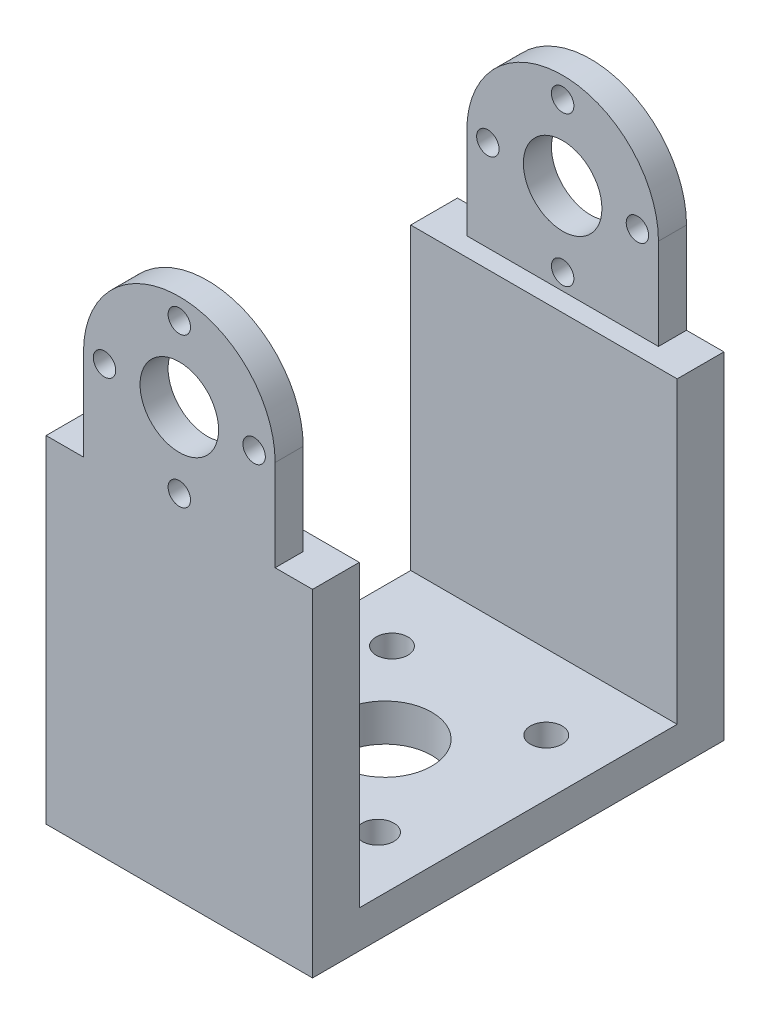
from build123d import *

# Parameters (mm, degrees)
BOSS_EXTRUDE1_DEPTH      = 22
BOSS_EXTRUDE1_DEPTH_BACK = 22
SKETCH1_R                = 1.2
SKETCH1_R_2              = 4.2
SKETCH2_W                = 38
SKETCH2_H                = 20
CUT_EXTRUDE1_DEPTH       = 105.423416914
SKETCH3_W                = 7
SKETCH3_H                = 44
BOSS_EXTRUDE2_DEPTH      = 36
SKETCH5_W                = 34
SKETCH5_H                = 50
CUT_EXTRUDE3_DEPTH       = 109.047443283
SKETCH6_W                = 20.5
SKETCH6_H                = 54.25
CUT_EXTRUDE4_DEPTH       = 111.605436123
SKETCH20_W               = 28.5
SKETCH20_H               = 34
SKETCH20_R               = 1.7
SKETCH20_R_2             = 5
BOSS_EXTRUDE5_DEPTH      = 4
SKETCH21_W               = 3
SKETCH21_H               = 36
CUT_EXTRUDE12_DEPTH      = 66.777085676


with BuildPart() as part:
    # Sketch1 → Boss-Extrude1 (new, two sides: drawn at the far end of the back side and taken through both)
    with BuildSketch(Plane.XY.offset(-BOSS_EXTRUDE1_DEPTH_BACK)):
        with BuildLine():
            ThreePointArc((10.25, 0), (0, 10.25), (-10.25, 0))
            Line((-10.25, 0), (-10.25, -100))
            Line((-10.25, -100), (10.25, -100))
            Line((10.25, -100), (10.25, 0))
        make_face()
        with Locations((8, 0)):
            Circle(SKETCH1_R, mode=Mode.SUBTRACT)
        with Locations((0, 8)):
            Circle(SKETCH1_R, mode=Mode.SUBTRACT)
        with Locations((-8, 0)):
            Circle(SKETCH1_R, mode=Mode.SUBTRACT)
        Circle(SKETCH1_R_2, mode=Mode.SUBTRACT)
        with Locations((0, -8)):
            Circle(SKETCH1_R, mode=Mode.SUBTRACT)
    extrude(amount=BOSS_EXTRUDE1_DEPTH + BOSS_EXTRUDE1_DEPTH_BACK)

    # Sketch2 → Cut-Extrude1 (cut, through all)
    with BuildSketch(Plane.ZY.offset(10.25)):
        with Locations((0, 0.25)):
            Rectangle(SKETCH2_W, SKETCH2_H)
    extrude(amount=-CUT_EXTRUDE1_DEPTH, mode=Mode.SUBTRACT)

    # Sketch3 → Boss-Extrude2 (add)
    with BuildSketch(Plane(origin=(0, -9.75, 0), x_dir=(1, 0, 0), z_dir=(0, 1, 0))):
        with Locations((-13.75, 0)):
            Rectangle(SKETCH3_W, SKETCH3_H)
        with Locations((13.75, 0)):
            Rectangle(SKETCH3_W, SKETCH3_H)
    extrude(amount=-BOSS_EXTRUDE2_DEPTH)

    # Sketch5 → Cut-Extrude3 (cut, through all)
    with BuildSketch(Plane.ZY.offset(17.25)):
        with Locations((0, -34.75)):
            Rectangle(SKETCH5_W, SKETCH5_H)
    extrude(amount=-CUT_EXTRUDE3_DEPTH, mode=Mode.SUBTRACT)

    # Sketch6 → Cut-Extrude4 (cut, through all)
    with BuildSketch(Plane.XY.offset(22)):
        with Locations((0, -72.875)):
            Rectangle(SKETCH6_W, SKETCH6_H)
    extrude(amount=-CUT_EXTRUDE4_DEPTH, mode=Mode.SUBTRACT)


with BuildPart() as cut_extrude4_piece_1:
    # of the separate pieces the step leaves, piece 1, a body of its own (cut_extrude4_pieces)
    add(part.part.solids().sort_by_distance((17.25, -45.75, -17))[0])



with BuildPart() as cut_extrude4_piece_2:
    # of the separate pieces the step leaves, piece 2, a body of its own (cut_extrude4_pieces)
    add(part.part.solids().sort_by_distance((-10.25, 0, 22))[0])


with BuildPart() as cut_extrude4_piece_1_1:
    add(cut_extrude4_piece_1.part)

    add(cut_extrude4_piece_2.part)  # Boss-Extrude5 merges Cut-Extrude4 piece 2
    # Sketch20 → Boss-Extrude5 (add)
    with BuildSketch(Plane.XZ.offset(45.75)):
        Rectangle(SKETCH20_W, SKETCH20_H)
        with Locations((-8.25, -9)):
            Circle(SKETCH20_R, mode=Mode.SUBTRACT)
        with Locations((8.25, -9)):
            Circle(SKETCH20_R, mode=Mode.SUBTRACT)
        with Locations((-8.25, 9)):
            Circle(SKETCH20_R, mode=Mode.SUBTRACT)
        Circle(SKETCH20_R_2, mode=Mode.SUBTRACT)
        with Locations((8.25, 9)):
            Circle(SKETCH20_R, mode=Mode.SUBTRACT)
    extrude(amount=-BOSS_EXTRUDE5_DEPTH)

    # Sketch21 → Cut-Extrude12 (cut, through all)
    with BuildSketch(Plane(origin=(0, 0, -22), x_dir=(-1, 0, 0), z_dir=(0, 0, -1))):
        with Locations((-15.75, -27.75)):
            Rectangle(SKETCH21_W, SKETCH21_H)
        with Locations((15.75, -27.75)):
            Rectangle(SKETCH21_W, SKETCH21_H)
    extrude(amount=-CUT_EXTRUDE12_DEPTH, mode=Mode.SUBTRACT)


solid = cut_extrude4_piece_1_1.part
